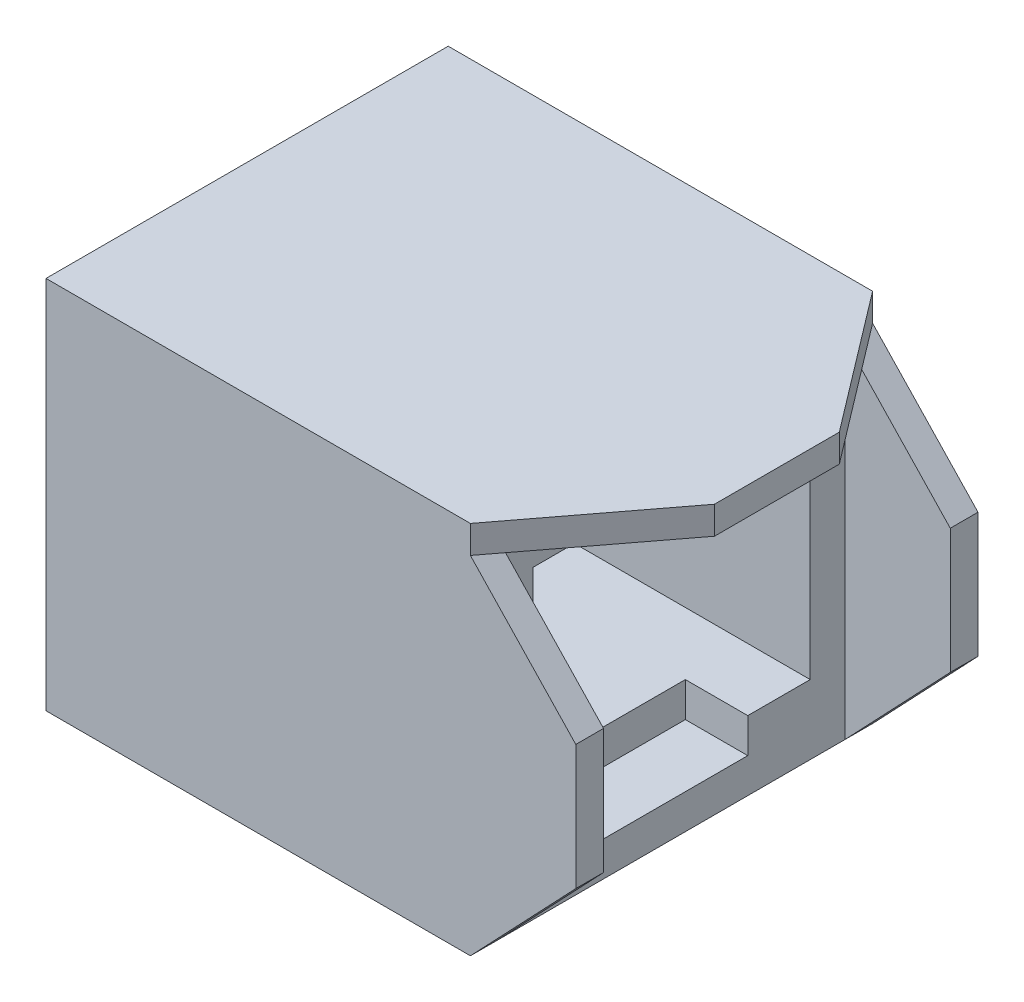
from build123d import *

# Parameters (mm, degrees)
SKETCH_1_W               = 29
SKETCH_1_H               = 29
SKETCH_1_W_2             = 25
SKETCH_1_H_2             = 25
EXTRUDE_1_DEPTH          = 36.2
SKETCH_1_3_W             = 25
SKETCH_1_3_H             = 25
SKETCH_1_3_W_2           = 20
SKETCH_1_3_H_2           = 17
EXTRUDE_2_DEPTH          = 28.6
SKETCH_1_4_W             = 29
SKETCH_1_4_H             = 29
EXTRUDE_3_DEPTH          = 2
SKETCH_1_5_W             = 20
SKETCH_1_5_H             = 17
SKETCH_1_5_W_2           = 8
SKETCH_1_5_H_2           = 8
EXTRUDE_4_DEPTH          = 1.1
CUT_EXTRUDE_1_DEPTH      = 49.597222143
CUT_EXTRUDE_2_REACH      = 49.431
CUT_EXTRUDE_3_DEPTH      = 2
CUT_EXTRUDE_3_DEPTH_BACK = 2
CUT_EXTRUDE_3_START      = -14.5
SKETCH_7_W               = 50
SKETCH_7_H               = 1
HOLE_WIZARD_1_D          = 1.8
HOLE_WIZARD_1_DEPTH      = 4
CUT_EXTRUDE_4_DEPTH      = 4.5


with BuildPart() as part:
    # 草图1 → 凸台-拉伸1 (new body)
    with BuildSketch(Plane(origin=(0, 0, 0), x_dir=(0, 0, -1), z_dir=(1, 0, 0))):
        Rectangle(SKETCH_1_W, SKETCH_1_H)
        Rectangle(SKETCH_1_W_2, SKETCH_1_H_2, mode=Mode.SUBTRACT)
    extrude(amount=EXTRUDE_1_DEPTH)

    # 草图1<3> → 凸台-拉伸2 (add)
    with BuildSketch(Plane(origin=(0, 0, 0), x_dir=(0, 0, -1), z_dir=(1, 0, 0))):
        Rectangle(SKETCH_1_3_W, SKETCH_1_3_H)
        with Locations((0, 1)):
            Rectangle(SKETCH_1_3_W_2, SKETCH_1_3_H_2, mode=Mode.SUBTRACT)
    extrude(amount=EXTRUDE_2_DEPTH)

    # 草图1<4> → 凸台-拉伸3 (add)
    with BuildSketch(Plane(origin=(0, 0, 0), x_dir=(0, 0, -1), z_dir=(1, 0, 0))):
        Rectangle(SKETCH_1_4_W, SKETCH_1_4_H)
    extrude(amount=-EXTRUDE_3_DEPTH)

    # 草图1<5> → 凸台-拉伸4 (add)
    with BuildSketch(Plane(origin=(0, 0, 0), x_dir=(0, 0, -1), z_dir=(1, 0, 0))):
        with Locations((0, 1)):
            Rectangle(SKETCH_1_5_W, SKETCH_1_5_H)
        Rectangle(SKETCH_1_5_W_2, SKETCH_1_5_H_2, mode=Mode.SUBTRACT)
    extrude(amount=EXTRUDE_4_DEPTH)

    # 草图4 → 切除-拉伸1 (cut, through all)
    with BuildSketch(Plane.XY.offset(14.5)):
        Polygon((-2, -12.5), (28.6, -12.5), (36.2, -4.5), (36.2, -14.5), (-2, -14.5), align=None)
        Polygon((36.2, 12.5), (28.6, 12.5), (36.2, 4.5), align=None)
    extrude(amount=-CUT_EXTRUDE_1_DEPTH, mode=Mode.SUBTRACT)

    # 草图6 → 切除-拉伸2 (cut, up to next)
    with BuildSketch(Plane(origin=(0, 14.5, 0), x_dir=(1, 0, 0), z_dir=(0, 1, 0)), mode=Mode.PRIVATE) as cut_extrude_2_sk1:
        Polygon((28.6, 14.5), (36.2, 14.5), (36.2, 4.5), align=None)
    cut_extrude_2_tool1 = extrude(cut_extrude_2_sk1.sketch, amount=-CUT_EXTRUDE_2_REACH, mode=Mode.PRIVATE) & part.part
    # 草图6 → 切除-拉伸2 (cut, up to next)
    with BuildSketch(Plane(origin=(0, 14.5, 0), x_dir=(1, 0, 0), z_dir=(0, 1, 0)), mode=Mode.PRIVATE) as cut_extrude_2_sk2:
        Polygon((36.2, -14.5), (36.2, -4.5), (28.6, -14.5), align=None)
    cut_extrude_2_tool2 = extrude(cut_extrude_2_sk2.sketch, amount=-CUT_EXTRUDE_2_REACH, mode=Mode.PRIVATE) & part.part
    add(cut_extrude_2_tool1.solids().sort_by_distance((33.666667, 14.5, -11.166667))[0], mode=Mode.SUBTRACT)
    add(cut_extrude_2_tool2.solids().sort_by_distance((33.666667, 14.5, 11.166667))[0], mode=Mode.SUBTRACT)

    # 草图7 → 切除-拉伸3 (cut, two sides: drawn at the far end of the back side and taken through both)
    with BuildSketch(Plane.XY.offset(14.5).offset(CUT_EXTRUDE_3_START - CUT_EXTRUDE_3_DEPTH_BACK)):
        with Locations((23, 10)):
            Rectangle(SKETCH_7_W, SKETCH_7_H)
    extrude(amount=CUT_EXTRUDE_3_DEPTH + CUT_EXTRUDE_3_DEPTH_BACK, mode=Mode.SUBTRACT)

    # 孔1
    with Locations(Plane(origin=(0, -12.5, 0), x_dir=(-1, 0, 0), z_dir=(0, -1, 0))):
        with Locations((-1, 0)):
            Hole(HOLE_WIZARD_1_D / 2, depth=HOLE_WIZARD_1_DEPTH)

    # 草图11 → 切除-拉伸4 (cut)
    with BuildSketch(Plane(origin=(28.6, 0, 0), x_dir=(0, 0, -1), z_dir=(1, 0, 0))):
        Polygon((0, -7.5), (-5.5, -7.5), (-5.5, -10), (5.5, -10), (5.5, -7.5), align=None)
    extrude(amount=-CUT_EXTRUDE_4_DEPTH, mode=Mode.SUBTRACT)


solid = part.part
